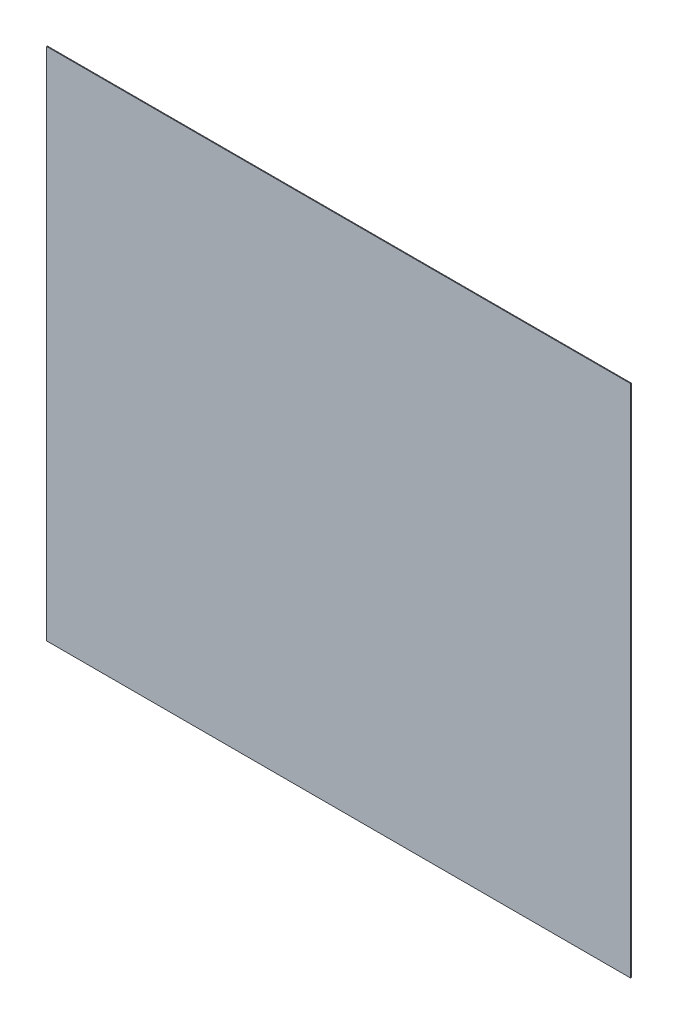
from build123d import *

# Parameters (mm, degrees)
SKETCH1_W           = 1100
SKETCH1_H           = 970
BOSS_EXTRUDE1_DEPTH = 1.5


with BuildPart() as part:
    # Sketch1 → Boss-Extrude1 (new body)
    with BuildSketch(Plane.XY):
        Rectangle(SKETCH1_W, SKETCH1_H)
    extrude(amount=BOSS_EXTRUDE1_DEPTH)


solid = part.part
